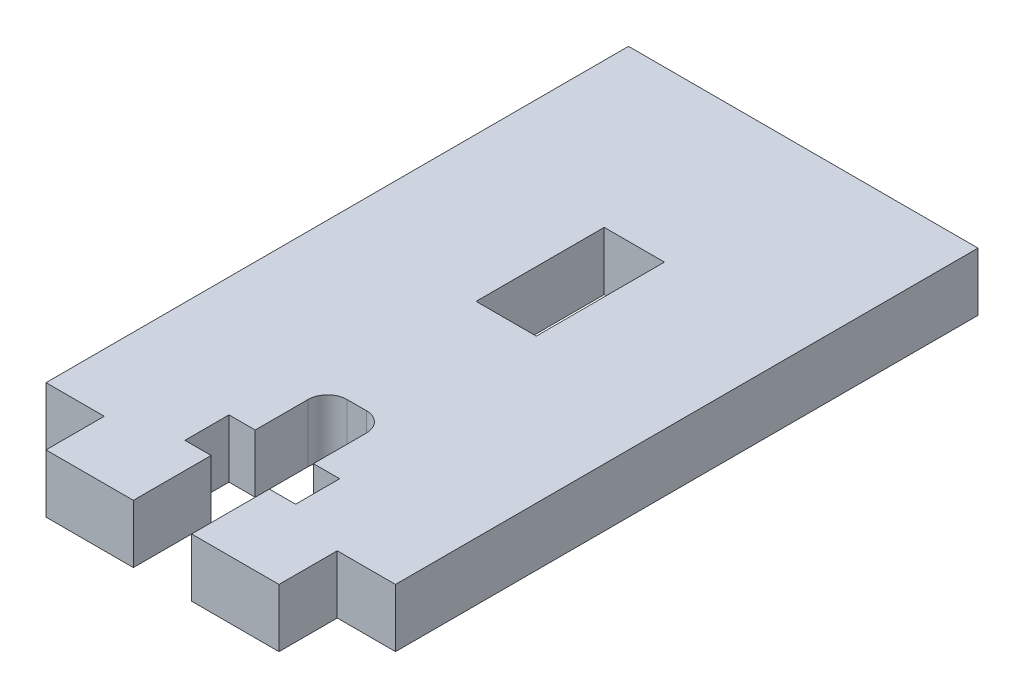
from build123d import *

# Parameters (mm, degrees)
SKETCH1_W               = 18
SKETCH1_H               = 30
BOSS_EXTRUDE1_DEPTH     = 1.5
SKETCH2_W               = 12
SKETCH2_H               = 3
BOSS_EXTRUDE2_DEPTH     = 1.5
CUT_EXTRUDE2_DEPTH      = 21.180436071
CUT_EXTRUDE2_DEPTH_BACK = 21.180436071
CUT_EXTRUDE1_DEPTH      = 21.180436071
CUT_EXTRUDE1_DEPTH_BACK = 21.180436071
SKETCH3_W               = 3.1
SKETCH3_H               = 6.6


with BuildPart() as part:
    # Sketch1 → Boss-Extrude1 (new, symmetric)
    with BuildSketch(Plane(origin=(0, 0, 0), x_dir=(1, 0, 0), z_dir=(0, 1, 0))):
        Rectangle(SKETCH1_W, SKETCH1_H)
    extrude(amount=BOSS_EXTRUDE1_DEPTH, both=True)

    # Sketch2 → Boss-Extrude2 (add, symmetric)
    with BuildSketch(Plane(origin=(0, 0, 0), x_dir=(1, 0, 0), z_dir=(0, 1, 0))):
        with Locations((0, -16.5)):
            Rectangle(SKETCH2_W, SKETCH2_H)
    extrude(amount=BOSS_EXTRUDE2_DEPTH, both=True)

    # Sketch4 → Cut-Extrude2 (cut, two sides: drawn at the far end of the back side and taken through both)
    with BuildSketch(Plane(origin=(0, 0, 0), x_dir=(1, 0, 0), z_dir=(0, 1, 0)).offset(-CUT_EXTRUDE2_DEPTH_BACK)):
        with BuildLine():
            Line((-1.5, -18), (1.5, -18))
            Line((1.5, -18), (1.5, -13.996114826))
            Line((1.5, -13.996114826), (2.85, -13.996114826))
            Line((2.85, -13.996114826), (2.85, -11.726114826))
            Line((2.85, -11.726114826), (1.5, -11.726114826))
            Line((1.5, -11.726114826), (1.5, -9))
            ThreePointArc((1.5, -9), (1.207106781, -8.292893219), (0.5, -8))
            Line((0.5, -8), (-0.5, -8))
            ThreePointArc((-0.5, -8), (-1.207106781, -8.292893219), (-1.5, -9))
            Line((-1.5, -9), (-1.5, -11.726114826))
            Line((-1.5, -11.726114826), (-2.85, -11.726114826))
            Line((-2.85, -11.726114826), (-2.85, -13.996114826))
            Line((-2.85, -13.996114826), (-1.5, -13.996114826))
            Line((-1.5, -13.996114826), (-1.5, -18))
        make_face()
    extrude(amount=CUT_EXTRUDE2_DEPTH + CUT_EXTRUDE2_DEPTH_BACK, mode=Mode.SUBTRACT)

    # Sketch3 → Cut-Extrude1 (cut, two sides: drawn at the far end of the back side and taken through both)
    with BuildSketch(Plane(origin=(0, 0, 0), x_dir=(1, 0, 0), z_dir=(0, 1, 0)).offset(-CUT_EXTRUDE1_DEPTH_BACK)):
        with Locations((0, 3)):
            Rectangle(SKETCH3_W, SKETCH3_H)
    extrude(amount=CUT_EXTRUDE1_DEPTH + CUT_EXTRUDE1_DEPTH_BACK, mode=Mode.SUBTRACT)


solid = part.part
